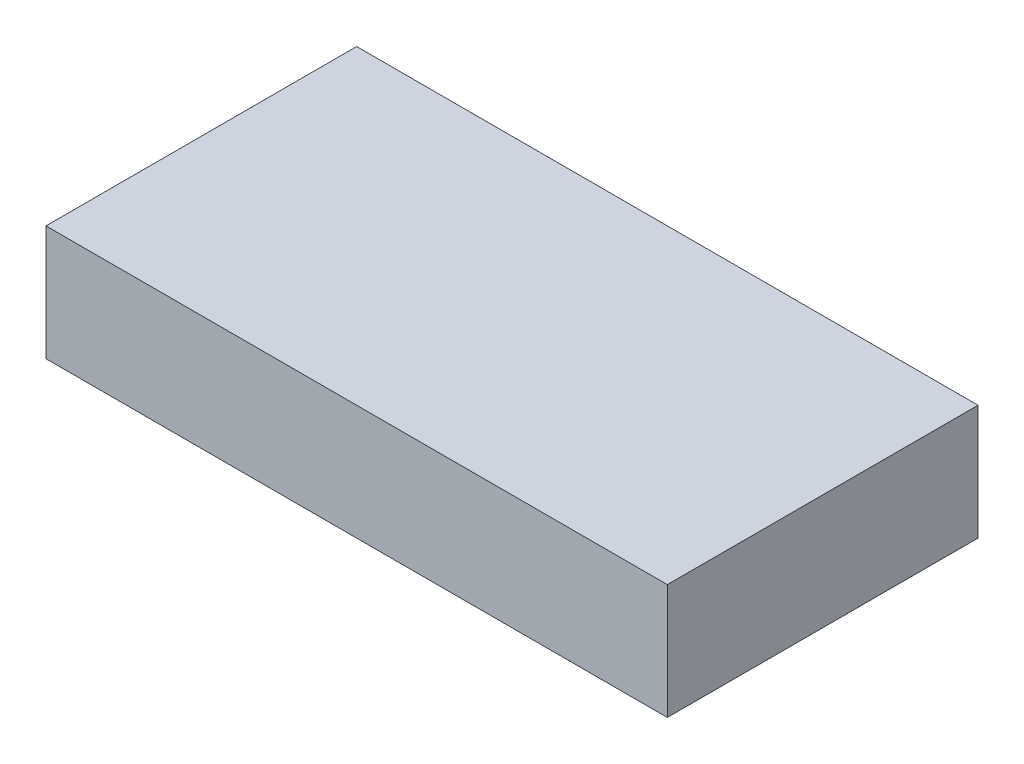
from build123d import *

# Parameters (mm, degrees)
SKETCH2_W           = 48
SKETCH2_H           = 24
BOSS_EXTRUDE1_DEPTH = 8.89


with BuildPart() as part:
    # Sketch2 → Boss-Extrude1 (new body)
    with BuildSketch(Plane(origin=(0, 0, 0), x_dir=(1, 0, 0), z_dir=(0, 1, 0))):
        with Locations((24, 12)):
            Rectangle(SKETCH2_W, SKETCH2_H)
    extrude(amount=BOSS_EXTRUDE1_DEPTH)


solid = part.part
